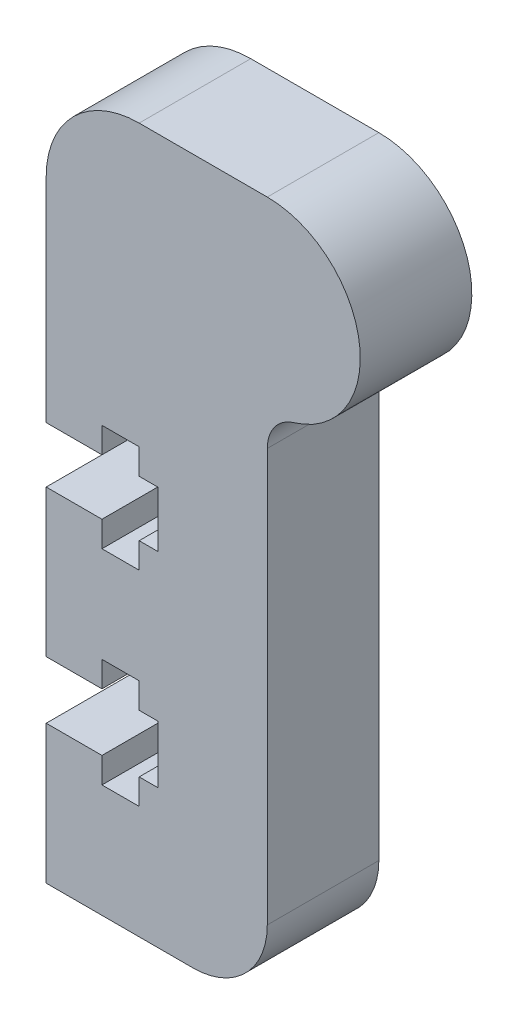
from build123d import *

# Parameters (mm, degrees)
DODANIE_WYCI_GNI_CIE1_DEPTH = 6


with BuildPart() as part:
    # Szkic2 → Dodanie-wyciągnięcie1 (new body)
    with BuildSketch(Plane.XY):
        with BuildLine():
            Line((5, 93.695492388), (11.889307623, 93.695492388))
            ThreePointArc((11.889307623, 93.695492388), (16.836926807, 89.417340299), (13.317879052, 83.903918151))
            ThreePointArc((13.317879052, 83.903918151), (12.285740172, 83.182517065), (11.889307623, 81.987288456))
            Line((11.889307623, 81.987288456), (11.889307623, 59.797095598))
            ThreePointArc((11.889307623, 59.797095598), (10.717734748, 56.968668473), (7.889307623, 55.797095598))
            Line((7.889307623, 55.797095598), (0, 55.797095598))
            Line((0, 55.797095598), (0, 63.247095598))
            Line((0, 63.247095598), (3, 63.247095598))
            Line((3, 63.247095598), (3, 61.872095598))
            Line((3, 61.872095598), (5, 61.872095598))
            Line((5, 61.872095598), (5, 63.247095598))
            Line((5, 63.247095598), (6, 63.247095598))
            Line((6, 63.247095598), (6, 66.347095598))
            Line((6, 66.347095598), (5, 66.347095598))
            Line((5, 66.347095598), (5, 67.722095598))
            Line((5, 67.722095598), (3, 67.722095598))
            Line((3, 67.722095598), (3, 66.347095598))
            Line((3, 66.347095598), (0, 66.347095598))
            Line((0, 66.347095598), (0, 74.247095598))
            Line((0, 74.247095598), (3, 74.247095598))
            Line((3, 74.247095598), (3, 72.872095598))
            Line((3, 72.872095598), (5, 72.872095598))
            Line((5, 72.872095598), (5, 74.247095598))
            Line((5, 74.247095598), (6, 74.247095598))
            Line((6, 74.247095598), (6, 77.245492388))
            Line((6, 77.245492388), (5, 77.245492388))
            Line((5, 77.245492388), (5, 78.620492388))
            Line((5, 78.620492388), (3, 78.620492388))
            Line((3, 78.620492388), (3, 77.245492388))
            Line((3, 77.245492388), (0, 77.245492388))
            Line((0, 77.245492388), (0, 88.695492388))
            ThreePointArc((0, 88.695492388), (1.464466094, 92.231026294), (5, 93.695492388))
        make_face()
    extrude(amount=-DODANIE_WYCI_GNI_CIE1_DEPTH)


solid = part.part
